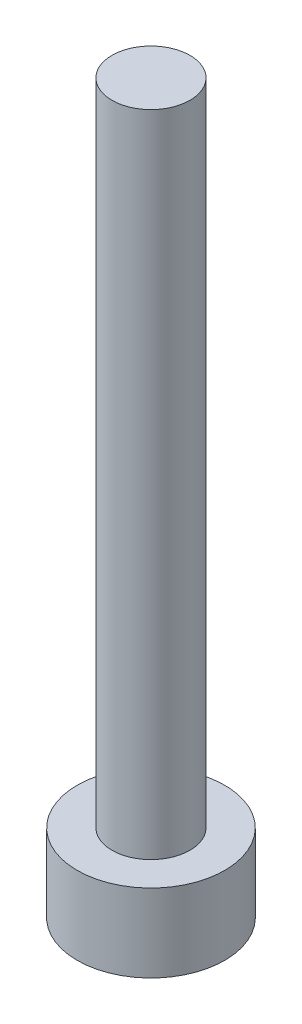
from build123d import *

# Parameters (mm, degrees)
SKETCH1_R           = 2.84
BOSS_EXTRUDE1_DEPTH = 3
SKETCH2_R           = 1.5
BOSS_EXTRUDE2_DEPTH = 25
CUT_EXTRUDE1_DEPTH  = 1.3


with BuildPart() as part:
    # Sketch1 → Boss-Extrude1 (new body)
    with BuildSketch(Plane(origin=(0, 0, 0), x_dir=(1, 0, 0), z_dir=(0, 1, 0))):
        with Locations(Location((0, 0, 0), (0, 0, 270))):
            Circle(SKETCH1_R)
    extrude(amount=BOSS_EXTRUDE1_DEPTH)

    # Sketch2 → Boss-Extrude2 (add)
    with BuildSketch(Plane(origin=(0, 3, 0), x_dir=(1, 0, 0), z_dir=(0, 1, 0))):
        with Locations(Location((0, 0, 0), (0, 0, 270))):
            Circle(SKETCH2_R)
    extrude(amount=BOSS_EXTRUDE2_DEPTH)

    # Sketch3 → Cut-Extrude1 (cut)
    with BuildSketch(Plane.XZ):
        Polygon((0.744781847, 1.29), (-0.744781847, 1.29), (-1.489563695, 0), (-0.744781847, -1.29), (0.744781847, -1.29), (1.489563695, 0), align=None)
    extrude(amount=-CUT_EXTRUDE1_DEPTH, mode=Mode.SUBTRACT)


solid = part.part
